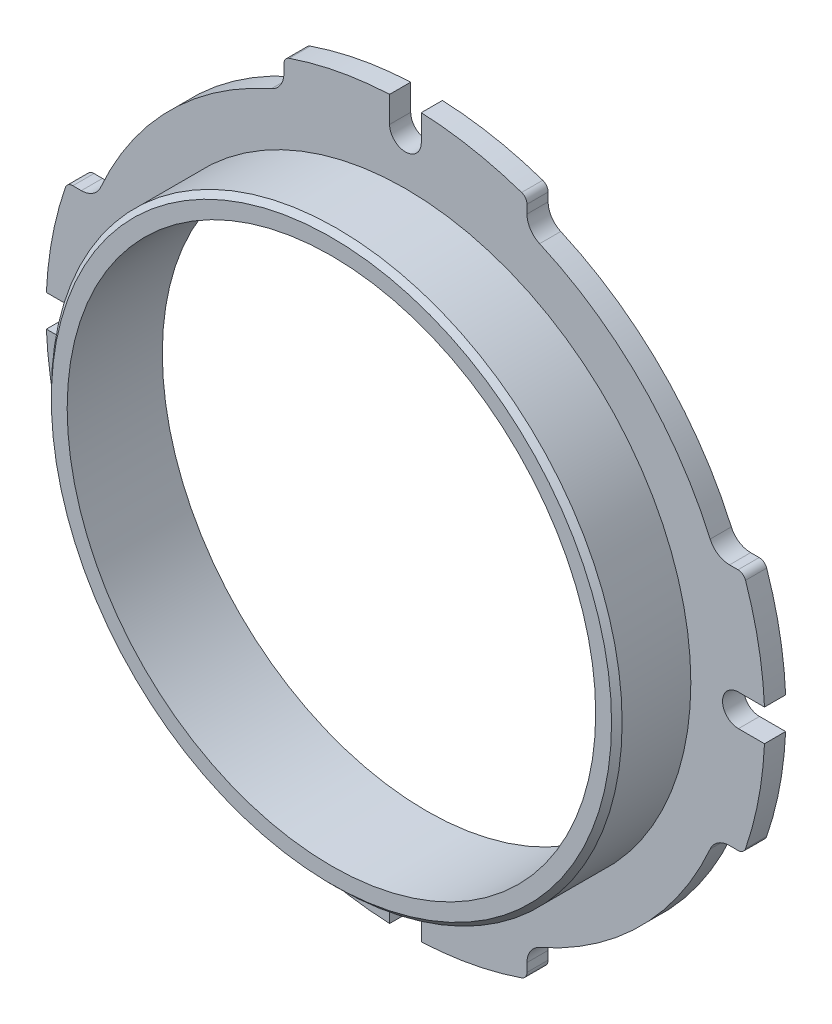
from build123d import *

# Parameters (mm, degrees)
SKETCH1_R           = 25
BOSS_EXTRUDE1_DEPTH = 2
SKETCH2_R           = 27
SKETCH2_R_2         = 25
BOSS_EXTRUDE2_DEPTH = 7
CUT_EXTRUDE1_DEPTH  = 49.590122453
CHAMFER1_SIZE       = 0.5


with BuildPart() as part:
    # Sketch1 → Boss-Extrude1 (new body)
    with BuildSketch(Plane.XY):
        with BuildLine():
            Line((-11.5, 30.659419425), (-11.5, 31.464265445))
            ThreePointArc((-11.5, 31.464265445), (-11.36006594, 31.900521733), (-10.992481203, 32.173985718))
            ThreePointArc((-10.992481203, 32.173985718), (0, 34), (10.992481203, 32.173985718))
            ThreePointArc((10.992481203, 32.173985718), (11.36006594, 31.900521733), (11.5, 31.464265445))
            Line((11.5, 31.464265445), (11.5, 30.659419425))
            ThreePointArc((11.5, 30.659419425), (11.824896973, 29.566702695), (12.694029851, 28.829006324))
            ThreePointArc((12.694029851, 28.829006324), (22.273863602, 22.273863602), (28.829006324, 12.694029851))
            ThreePointArc((28.829006324, 12.694029851), (29.566702695, 11.824896973), (30.659419425, 11.5))
            Line((30.659419425, 11.5), (31.464265445, 11.5))
            ThreePointArc((31.464265445, 11.5), (31.900521733, 11.36006594), (32.173985718, 10.992481203))
            ThreePointArc((32.173985718, 10.992481203), (34, 0), (32.173985718, -10.992481203))
            ThreePointArc((32.173985718, -10.992481203), (31.900521733, -11.36006594), (31.464265445, -11.5))
            Line((31.464265445, -11.5), (30.659419425, -11.5))
            ThreePointArc((30.659419425, -11.5), (29.566702695, -11.824896973), (28.829006324, -12.694029851))
            ThreePointArc((28.829006324, -12.694029851), (22.273863602, -22.273863602), (12.694029851, -28.829006324))
            ThreePointArc((12.694029851, -28.829006324), (11.824896973, -29.566702695), (11.5, -30.659419425))
            Line((11.5, -30.659419425), (11.5, -31.464265445))
            ThreePointArc((11.5, -31.464265445), (11.36006594, -31.900521733), (10.992481203, -32.173985718))
            ThreePointArc((10.992481203, -32.173985718), (0, -34), (-10.992481203, -32.173985718))
            ThreePointArc((-10.992481203, -32.173985718), (-11.36006594, -31.900521733), (-11.5, -31.464265445))
            Line((-11.5, -31.464265445), (-11.5, -30.659419425))
            ThreePointArc((-11.5, -30.659419425), (-11.824896973, -29.566702695), (-12.694029851, -28.829006324))
            ThreePointArc((-12.694029851, -28.829006324), (-22.273863602, -22.273863602), (-28.829006324, -12.694029851))
            ThreePointArc((-28.829006324, -12.694029851), (-29.566702695, -11.824896973), (-30.659419425, -11.5))
            Line((-30.659419425, -11.5), (-31.464265445, -11.5))
            ThreePointArc((-31.464265445, -11.5), (-31.900521733, -11.36006594), (-32.173985718, -10.992481203))
            ThreePointArc((-32.173985718, -10.992481203), (-34, 0), (-32.173985718, 10.992481203))
            ThreePointArc((-32.173985718, 10.992481203), (-31.900521733, 11.36006594), (-31.464265445, 11.5))
            Line((-31.464265445, 11.5), (-30.659419425, 11.5))
            ThreePointArc((-30.659419425, 11.5), (-29.566702695, 11.824896973), (-28.829006324, 12.694029851))
            ThreePointArc((-28.829006324, 12.694029851), (-22.273863602, 22.273863602), (-12.694029851, 28.829006324))
            ThreePointArc((-12.694029851, 28.829006324), (-11.824896973, 29.566702695), (-11.5, 30.659419425))
        make_face()
        Circle(SKETCH1_R, mode=Mode.SUBTRACT)
    extrude(amount=BOSS_EXTRUDE1_DEPTH)

    # Sketch2 → Boss-Extrude2 (add)
    with BuildSketch(Plane.XY.offset(2)):
        Circle(SKETCH2_R)
        Circle(SKETCH2_R_2, mode=Mode.SUBTRACT)
    extrude(amount=BOSS_EXTRUDE2_DEPTH)

    # Sketch3 → Cut-Extrude1 (cut, through all)
    with BuildSketch(Plane.XY.offset(2)):
        with BuildLine():
            Line((31.5, 1.5), (35.327471806, 1.5))
            Line((35.327471806, 1.5), (35.327471806, -1.5))
            Line((35.327471806, -1.5), (31.5, -1.5))
            ThreePointArc((31.5, -1.5), (30, 0), (31.5, 1.5))
        make_face()
        with BuildLine():
            Line((-1.5, -31.5), (-1.5, -34.385950358))
            Line((-1.5, -34.385950358), (1.5, -34.385950358))
            Line((1.5, -34.385950358), (1.5, -31.5))
            ThreePointArc((1.5, -31.5), (0, -30), (-1.5, -31.5))
        make_face()
        with BuildLine():
            Line((-31.5, -1.5), (-36.640801576, -1.5))
            Line((-36.640801576, -1.5), (-36.640801576, 1.5))
            Line((-36.640801576, 1.5), (-31.5, 1.5))
            ThreePointArc((-31.5, 1.5), (-30, 0), (-31.5, -1.5))
        make_face()
        with BuildLine():
            Line((-1.5, 31.5), (-1.5, 35.301296781))
            Line((-1.5, 35.301296781), (1.5, 35.301296781))
            Line((1.5, 35.301296781), (1.5, 31.5))
            ThreePointArc((1.5, 31.5), (0, 30), (-1.5, 31.5))
        make_face()
    extrude(amount=-CUT_EXTRUDE1_DEPTH, mode=Mode.SUBTRACT)

    # Chamfer1
    chamfer1_edges = [part.edges().sort_by_distance(p)[0] for p in [
        (-27, 0, 9),
    ]]
    chamfer(chamfer1_edges, length=CHAMFER1_SIZE)


solid = part.part
